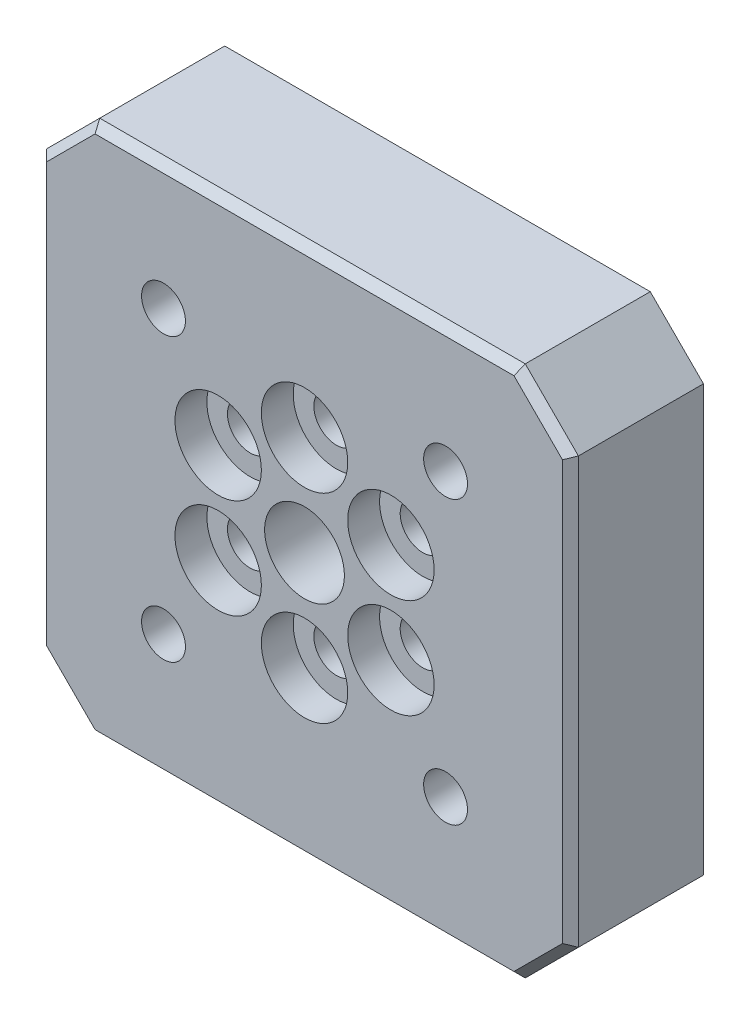
from build123d import *

# Parameters (mm, degrees)
SKETCH1_W                                            = 40
SKETCH1_H                                            = 40
BOSS_EXTRUDE1_DEPTH                                  = 10
F_6_0MM_DOWEL_HOLE1_D                                = 6
CBORE_FOR_M3_HEX_SOCKET_THIN_HEAD_CAP_SC_D           = 3.4
CBORE_FOR_M3_HEX_SOCKET_THIN_HEAD_CAP_SC_CBORE_D     = 6.5
CBORE_FOR_M3_HEX_SOCKET_THIN_HEAD_CAP_SC_CBORE_DEPTH = 2.4
TAP_DRILL_FOR_M4_TAP1_D                              = 3.3
CHAMFER1_SIZE                                        = 4
CHAMFER2_SIZE                                        = 0.6


with BuildPart() as part:
    # Sketch1 → Boss-Extrude1 (new body)
    with BuildSketch(Plane.XY):
        with Locations((20, 20)):
            Rectangle(SKETCH1_W, SKETCH1_H)
    extrude(amount=BOSS_EXTRUDE1_DEPTH)

    # Ø6.0mm Dowel Hole1 (through all)
    with Locations(Plane.XY.offset(10)):
        with Locations((20, 20)):
            Hole(F_6_0MM_DOWEL_HOLE1_D / 2)

    # CBORE for M3 Hex Socket Thin Head Cap Screw4 (through all)
    with Locations(Plane.XY.offset(10)):
        with Locations((13.504809472, 23.75), (20, 27.5), (26.495190528, 23.75), (26.495190528, 16.25), (20, 12.5), (13.504809472, 16.25)):
            CounterBoreHole(CBORE_FOR_M3_HEX_SOCKET_THIN_HEAD_CAP_SC_D / 2, CBORE_FOR_M3_HEX_SOCKET_THIN_HEAD_CAP_SC_CBORE_D / 2, CBORE_FOR_M3_HEX_SOCKET_THIN_HEAD_CAP_SC_CBORE_DEPTH)

    # Tap Drill for M4 Tap1 (through all)
    with Locations(Plane.XY.offset(10)):
        with Locations((9.393398282, 9.393398282), (9.393398282, 30.606601718), (30.606601718, 30.606601718), (30.606601718, 9.393398282)):
            Hole(TAP_DRILL_FOR_M4_TAP1_D / 2)

    # Chamfer1
    chamfer1_edges = [part.edges().sort_by_distance(p)[0] for p in [
        (0, 40, 5),
        (40, 40, 5),
        (40, 0, 5),
        (0, 0, 5),
    ]]
    chamfer(chamfer1_edges, length=CHAMFER1_SIZE)

    # Chamfer2
    chamfer2_edges = [part.edges().sort_by_distance(p)[0] for p in [
        (38, 2, 10),
        (40, 20, 10),
        (20, 0, 10),
        (0, 20, 10),
        (20, 40, 10),
        (2, 38, 10),
        (2, 2, 10),
        (38, 38, 10),
    ]]
    chamfer(chamfer2_edges, length=CHAMFER2_SIZE)


solid = part.part
